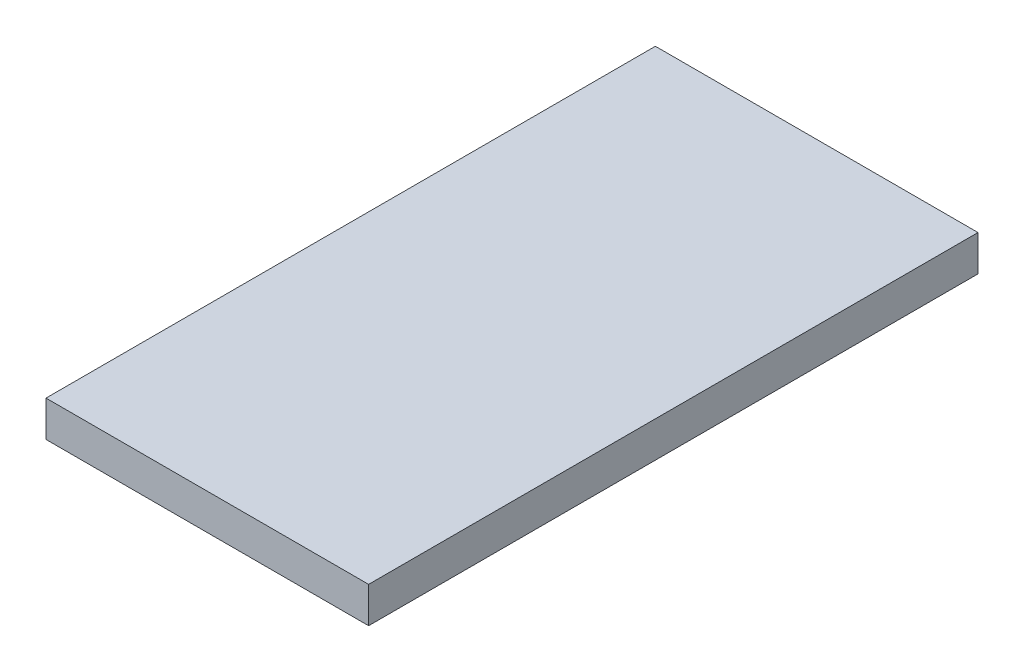
from build123d import *

# Parameters (mm, degrees)
SKETCH1_W                    = 180
SKETCH1_H                    = 20
UCY_TABAN_180X20X340_1_DEPTH = 340


with BuildPart() as part:
    # Sketch1 → UCY_taban_180x20x340_1 (new body)
    with BuildSketch(Plane.XY):
        with Locations((0, 10)):
            Rectangle(SKETCH1_W, SKETCH1_H)
    extrude(amount=-UCY_TABAN_180X20X340_1_DEPTH)


solid = part.part
